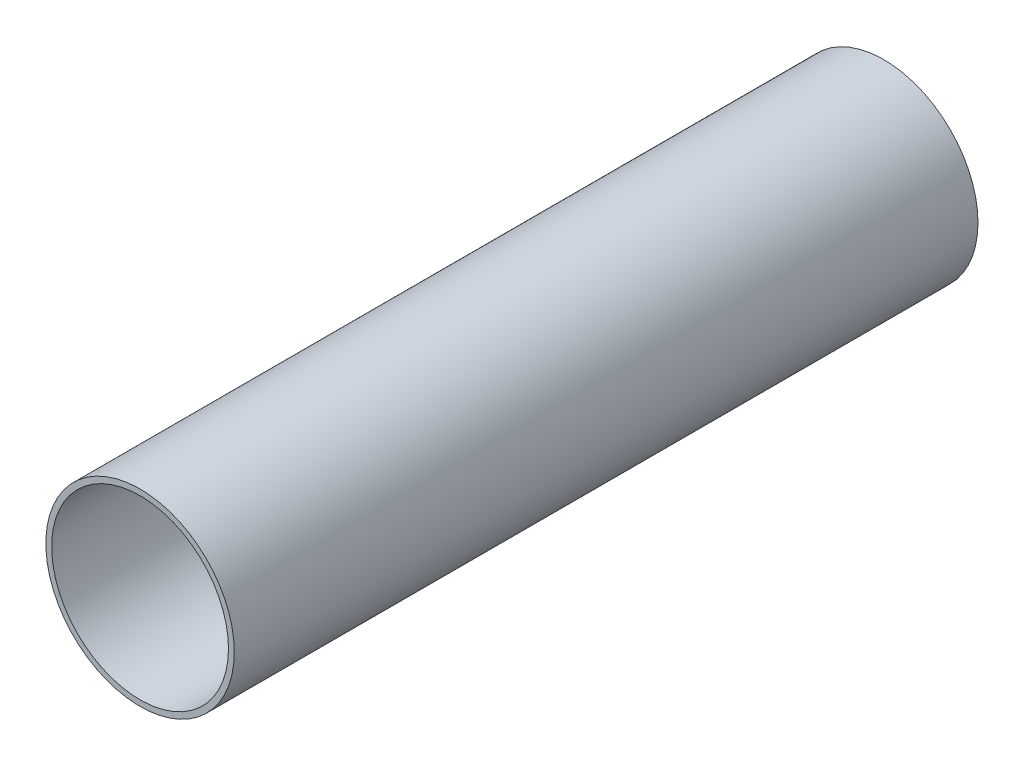
from build123d import *

# Parameters (mm, degrees)
SKETCH1_R           = 34.671
SKETCH1_R_2         = 32.5374
BOSS_EXTRUDE1_DEPTH = 273.685


with BuildPart() as part:
    # Sketch1 → Boss-Extrude1 (new body)
    with BuildSketch(Plane.XY):
        Circle(SKETCH1_R)
        Circle(SKETCH1_R_2, mode=Mode.SUBTRACT)
    extrude(amount=BOSS_EXTRUDE1_DEPTH)


solid = part.part
